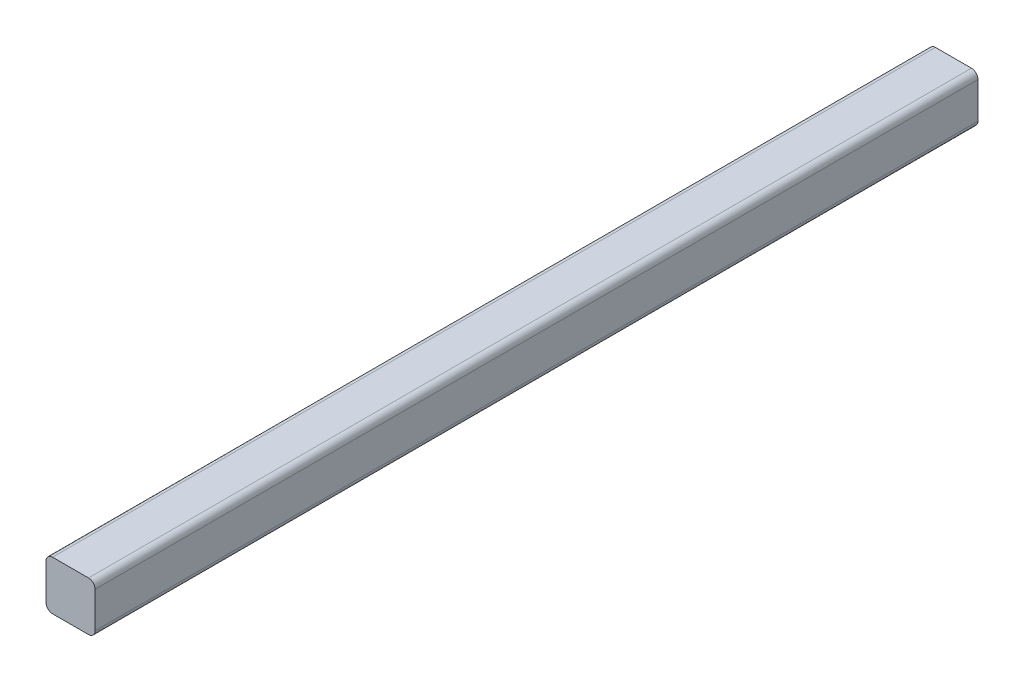
from build123d import *

# Parameters (mm, degrees)
SKETCH1_W           = 19.05
SKETCH1_H           = 19.05
BOSS_EXTRUDE1_DEPTH = 171.45
FILLET1_R           = 2.54


with BuildPart() as part:
    # Sketch1 → Boss-Extrude1 (new, symmetric)
    with BuildSketch(Plane.XY):
        Rectangle(SKETCH1_W, SKETCH1_H)
    extrude(amount=BOSS_EXTRUDE1_DEPTH, both=True)

    # Fillet1
    fillet1_edges = [part.edges().sort_by_distance(p)[0] for p in [
        (9.525, -9.525, 0),
        (-9.525, -9.525, 0),
        (-9.525, 9.525, 0),
        (9.525, 9.525, 0),
    ]]
    fillet(fillet1_edges, radius=FILLET1_R)


solid = part.part
